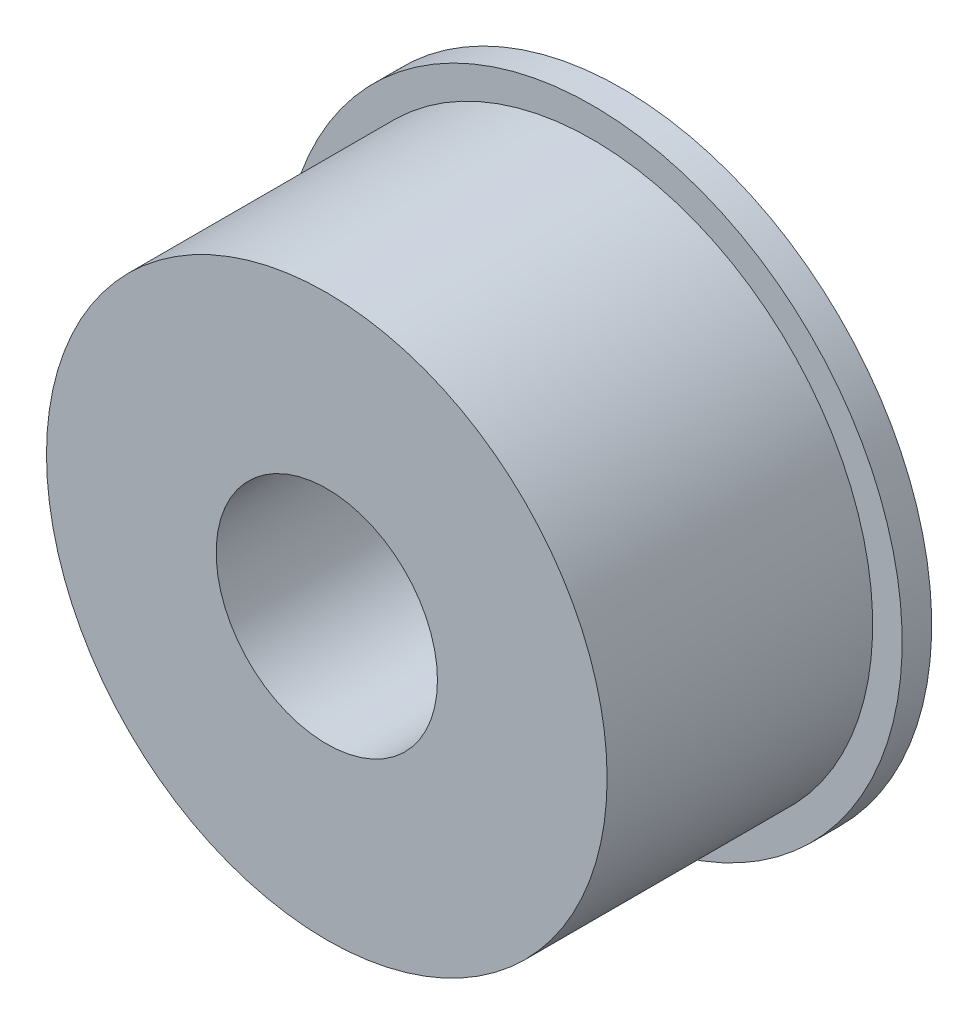
from build123d import *

# Parameters (mm, degrees)
SKETCH_1_R      = 19
SKETCH_1_R_2    = 7.5
EXTRUDE_1_DEPTH = 20
SKETCH_2_R      = 21
SKETCH_2_R_2    = 19
EXTRUDE_2_DEPTH = 2


with BuildPart() as part:
    # 草图1 → 凸台-拉伸1 (new body)
    with BuildSketch(Plane.XY):
        Circle(SKETCH_1_R)
        Circle(SKETCH_1_R_2, mode=Mode.SUBTRACT)
    extrude(amount=EXTRUDE_1_DEPTH)

    # 草图2 → 凸台-拉伸2 (add)
    with BuildSketch(Plane(origin=(0, 0, 0), x_dir=(-1, 0, 0), z_dir=(0, 0, -1))):
        Circle(SKETCH_2_R)
        Circle(SKETCH_2_R_2, mode=Mode.SUBTRACT)
    extrude(amount=-EXTRUDE_2_DEPTH)


solid = part.part
